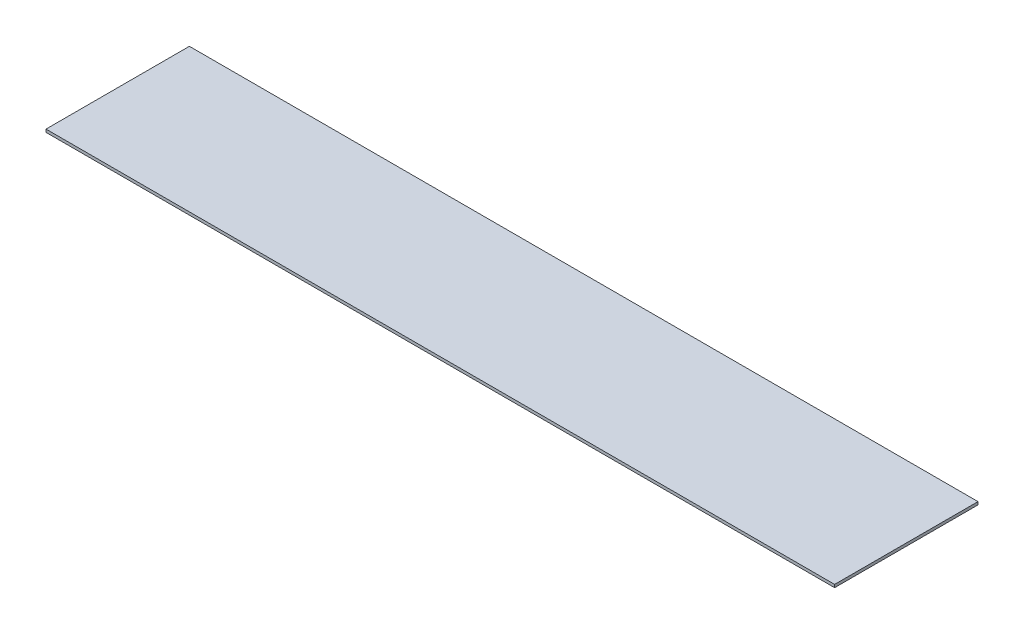
from build123d import *

# Parameters (mm, degrees)
SKETCH1_W           = 69.85
SKETCH1_H           = 12.7
BOSS_EXTRUDE1_DEPTH = 0.254


with BuildPart() as part:
    # Sketch1 → Boss-Extrude1 (new body)
    with BuildSketch(Plane(origin=(0, 0, 0), x_dir=(1, 0, 0), z_dir=(0, 1, 0))):
        Rectangle(SKETCH1_W, SKETCH1_H)
    extrude(amount=BOSS_EXTRUDE1_DEPTH)


solid = part.part
